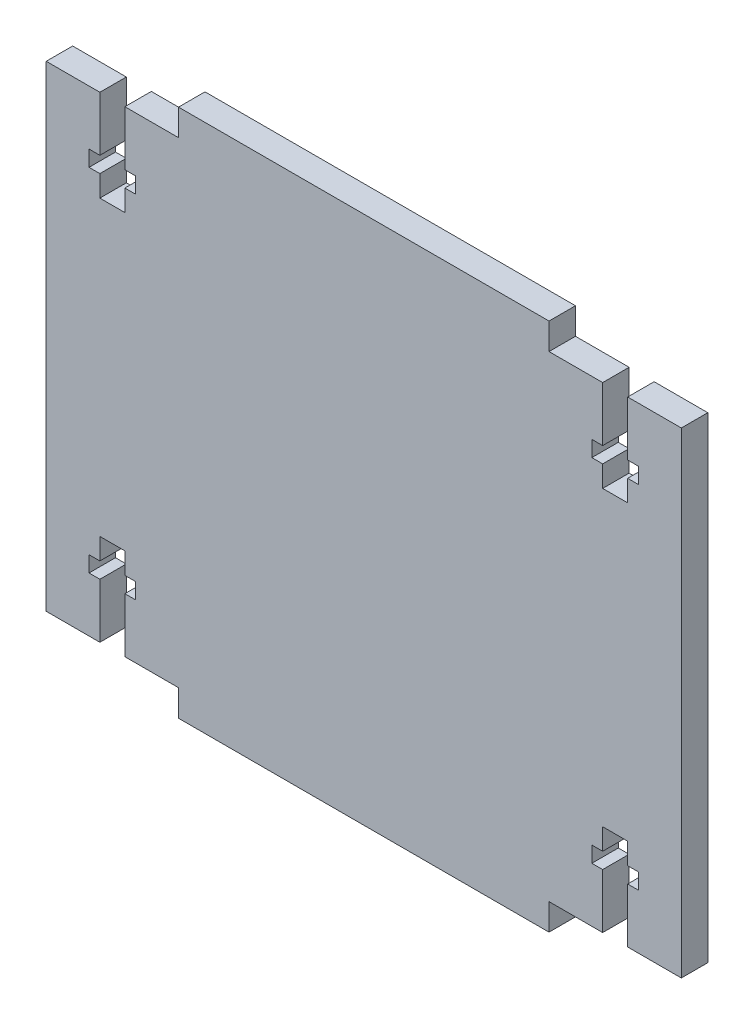
from build123d import *

# Parameters (mm, degrees)
SKETCH1_W           = 76.2
SKETCH1_H           = 63.5
BOSS_EXTRUDE1_DEPTH = 3.175
SKETCH2_W           = 15.875
SKETCH2_H           = 3.175
CUT_EXTRUDE1_DEPTH  = 50.6966108
CUT_EXTRUDE2_DEPTH  = 50.6966108


with BuildPart() as part:
    # Sketch1 → Boss-Extrude1 (new body)
    with BuildSketch(Plane.XY):
        Rectangle(SKETCH1_W, SKETCH1_H)
    extrude(amount=BOSS_EXTRUDE1_DEPTH)

    # Sketch2 → Cut-Extrude1 (cut, through all)
    with BuildSketch(Plane(origin=(0, 0, 0), x_dir=(-1, 0, 0), z_dir=(0, 0, -1))):
        with Locations((-30.1625, -30.1625)):
            Rectangle(SKETCH2_W, SKETCH2_H)
        with Locations((30.1625, -30.1625)):
            Rectangle(SKETCH2_W, SKETCH2_H)
        with Locations((30.1625, 30.1625)):
            Rectangle(SKETCH2_W, SKETCH2_H)
        with Locations((-30.1625, 30.1625)):
            Rectangle(SKETCH2_W, SKETCH2_H)
    extrude(amount=-CUT_EXTRUDE1_DEPTH, mode=Mode.SUBTRACT)

    # Sketch3 → Cut-Extrude2 (cut, through all)
    with BuildSketch(Plane.XY.offset(3.175)):
        Polygon((31.6625, -17.575), (31.6625, -20.125), (32.9625, -20.125), (32.9625, -22.025), (31.6625, -22.025), (31.6625, -28.575), (28.6625, -28.575), (28.6625, -22.025), (27.3625, -22.025), (27.3625, -20.125), (28.6625, -20.125), (28.6625, -17.575), align=None)
        Polygon((-31.6625, -20.125), (-32.9625, -20.125), (-32.9625, -22.025), (-31.6625, -22.025), (-31.6625, -28.575), (-28.6625, -28.575), (-28.6625, -22.025), (-27.3625, -22.025), (-27.3625, -20.125), (-28.6625, -20.125), (-28.6625, -17.575), (-31.6625, -17.575), align=None)
        Polygon((31.6625, 20.125), (32.9625, 20.125), (32.9625, 22.025), (31.6625, 22.025), (31.6625, 28.575), (28.6625, 28.575), (28.6625, 22.025), (27.3625, 22.025), (27.3625, 20.125), (28.6625, 20.125), (28.6625, 17.575), (31.6625, 17.575), align=None)
        Polygon((-31.6625, 17.575), (-31.6625, 20.125), (-32.9625, 20.125), (-32.9625, 22.025), (-31.6625, 22.025), (-31.6625, 28.575), (-28.6625, 28.575), (-28.6625, 22.025), (-27.3625, 22.025), (-27.3625, 20.125), (-28.6625, 20.125), (-28.6625, 17.575), align=None)
    extrude(amount=-CUT_EXTRUDE2_DEPTH, mode=Mode.SUBTRACT)


solid = part.part
